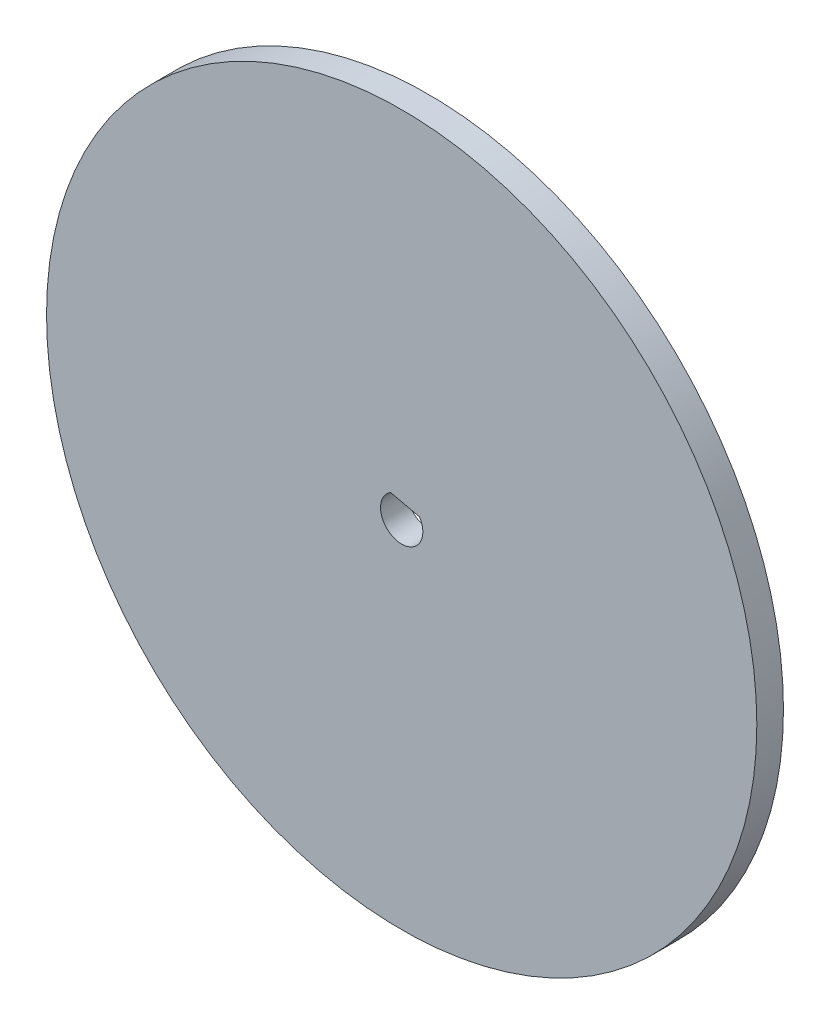
from build123d import *

# Parameters (mm, degrees)
SKETCH1_R           = 40
BOSS_EXTRUDE1_DEPTH = 3
CUT_EXTRUDE1_DEPTH  = 3


with BuildPart() as part:
    # Sketch1 → Boss-Extrude1 (new body)
    with BuildSketch(Plane.XY):
        Circle(SKETCH1_R)
    extrude(amount=BOSS_EXTRUDE1_DEPTH)

    # Sketch2 → Cut-Extrude1 (cut)
    with BuildSketch(Plane.XY.offset(3)):
        with BuildLine():
            Line((-1.249238699, 2.027252879), (2.006668261, 1.282042922))
            ThreePointArc((2.006668261, 1.282042922), (-0.531280863, -2.321226445), (-1.249238699, 2.027252879))
        make_face()
    extrude(amount=-CUT_EXTRUDE1_DEPTH, mode=Mode.SUBTRACT)


solid = part.part
